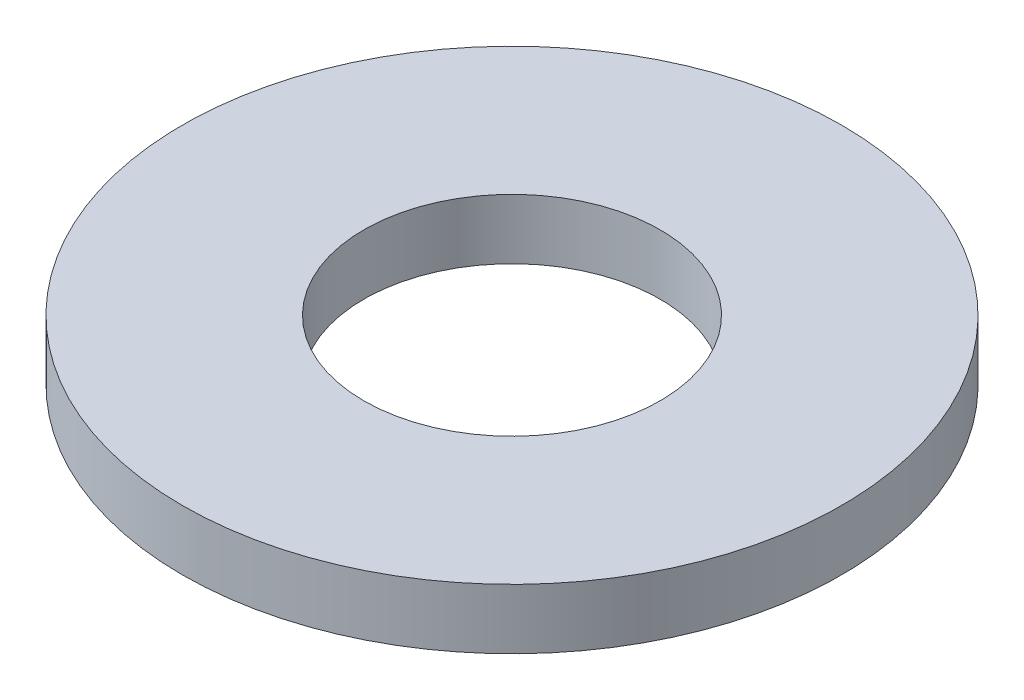
from build123d import *

# Parameters (mm, degrees)
SKETCH1_R           = 7.9375
BOSS_EXTRUDE1_DEPTH = 1.4478
SKETCH5_R           = 3.5687
CUT_EXTRUDE1_DEPTH  = 12.318300992


with BuildPart() as part:
    # Sketch1 → Boss-Extrude1 (new body)
    with BuildSketch(Plane(origin=(0, 0, 0), x_dir=(1, 0, 0), z_dir=(0, 1, 0))):
        with Locations(Location((0, 0, 0), (0, 0, 270))):
            Circle(SKETCH1_R)
    extrude(amount=BOSS_EXTRUDE1_DEPTH)

    # Sketch5 → Cut-Extrude1 (cut, through all)
    with BuildSketch(Plane(origin=(0, 1.4478, 0), x_dir=(-1, 0, 0), z_dir=(0, 1, 0))):
        with Locations(Location((0, 0, 0), (0, 0, 90))):
            Circle(SKETCH5_R)
    extrude(amount=-CUT_EXTRUDE1_DEPTH, mode=Mode.SUBTRACT)


solid = part.part
